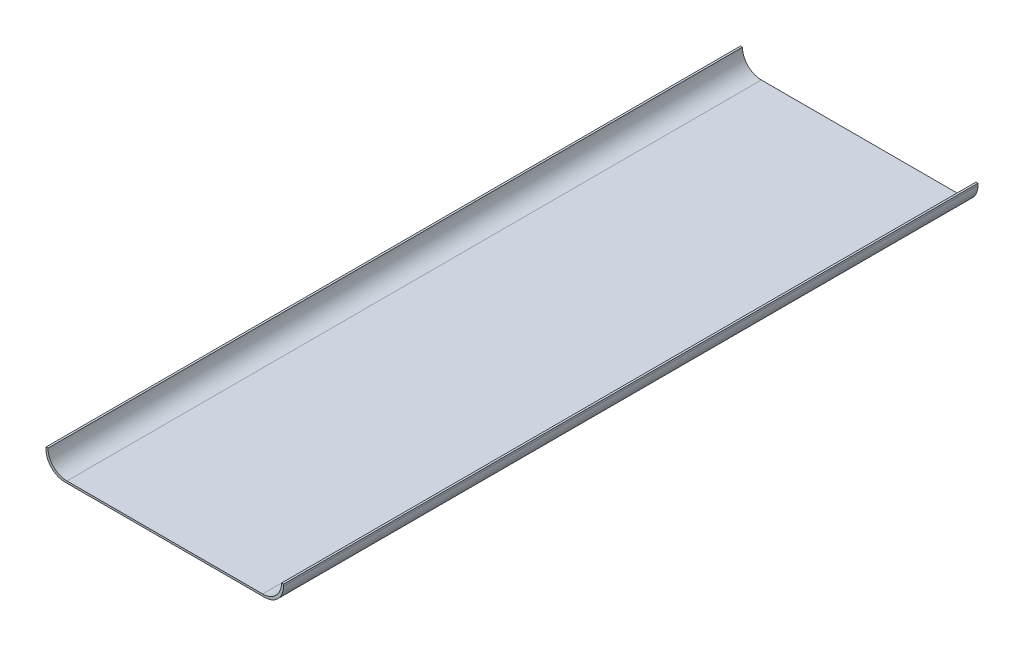
from build123d import *

# Parameters (mm, degrees)
BOSS_EXTRUDE1_DEPTH = 279.4


with BuildPart() as part:
    # Sketch1 → Boss-Extrude1 (new body)
    with BuildSketch(Plane.XY):
        with BuildLine():
            Line((46.99, -39.37), (47.78375, -39.37))
            Line((47.78375, -39.37), (47.78375, -40.16375))
            ThreePointArc((47.78375, -40.16375), (45.551903673, -45.551903673), (40.16375, -47.78375))
            Line((40.16375, -47.78375), (-40.16375, -47.78375))
            ThreePointArc((-40.16375, -47.78375), (-45.551903673, -45.551903673), (-47.78375, -40.16375))
            Line((-47.78375, -40.16375), (-47.78375, -39.37))
            Line((-47.78375, -39.37), (-46.99, -39.37))
            ThreePointArc((-46.99, -39.37), (-44.758153673, -44.758153673), (-39.37, -46.99))
            Line((-39.37, -46.99), (39.37, -46.99))
            ThreePointArc((39.37, -46.99), (44.758153673, -44.758153673), (46.99, -39.37))
        make_face()
    extrude(amount=BOSS_EXTRUDE1_DEPTH)


solid = part.part
